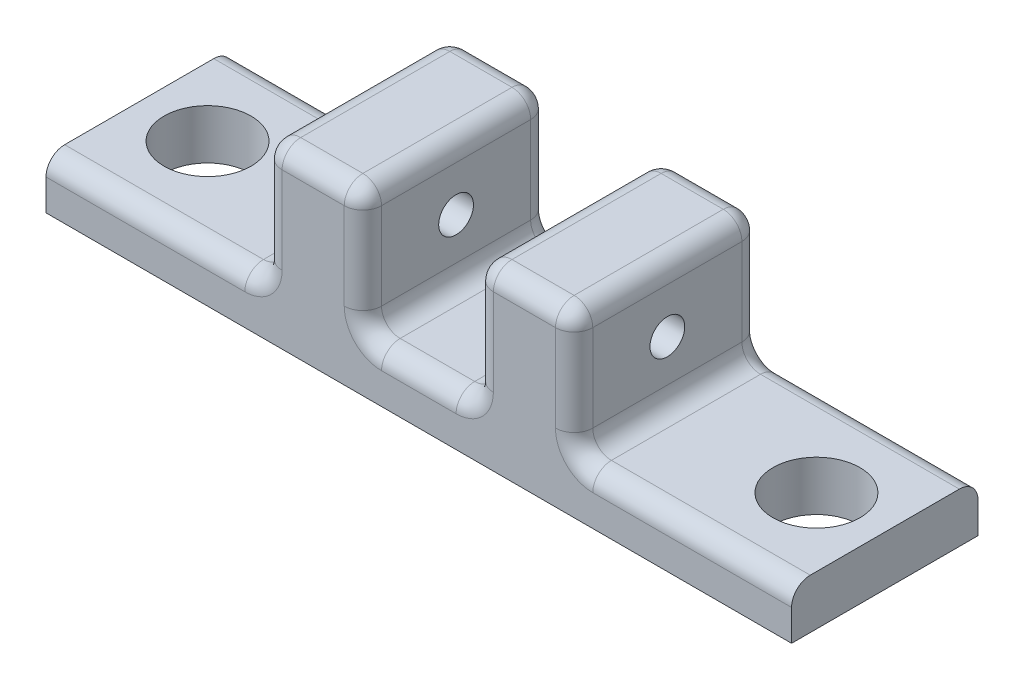
from build123d import *

# Parameters (mm, degrees)
SKETCH3_W               = 60
SKETCH3_H               = 15
SKETCH3_R               = 3.5
BOSS_EXTRUDE1_DEPTH     = 4
SKETCH6_W               = 8
SKETCH6_H               = 15
BOSS_EXTRUDE2_DEPTH     = 10
FILLET2_R               = 1.5
CUT_EXTRUDE1_DEPTH      = 46.370695388
CUT_EXTRUDE1_DEPTH_BACK = 46.370695388
SKETCH7_R               = 1.4


with BuildPart() as part:
    # Sketch3 → Boss-Extrude1 (new body)
    with BuildSketch(Plane(origin=(0, 0, 0), x_dir=(1, 0, 0), z_dir=(0, 1, 0))):
        Rectangle(SKETCH3_W, SKETCH3_H)
        with Locations(Location((-24.5, 0, 0), (0, 0, 270))):
            Circle(SKETCH3_R, mode=Mode.SUBTRACT)
        with Locations(Location((24.5, 0, 0), (0, 0, 270))):
            Circle(SKETCH3_R, mode=Mode.SUBTRACT)
    extrude(amount=BOSS_EXTRUDE1_DEPTH)

    # Sketch6 → Boss-Extrude2 (add)
    with BuildSketch(Plane(origin=(0, 4, 0), x_dir=(1, 0, 0), z_dir=(0, 1, 0))):
        with Locations((-8.5, 0)):
            Rectangle(SKETCH6_W, SKETCH6_H)
    boss_extrude2 = extrude(amount=BOSS_EXTRUDE2_DEPTH)

    # Mirror1: Boss-Extrude2 across plane
    add(boss_extrude2.mirror(Plane(origin=(0, 0, 0), x_dir=(0, 0, 1), z_dir=(1, 0, 0))))

    # Fillet2
    fillet2_edges = [part.edges().sort_by_distance(p)[0] for p in [
        (-21.25, 4, 7.5),
        (-21.25, 4, -7.5),
        (0, 4, 7.5),
        (-12.5, 4, 0),
        (-12.5, 9, -7.5),
        (-12.5, 9, 7.5),
        (-4.5, 4, 0),
        (-4.5, 9, 7.5),
        (-4.5, 9, -7.5),
        (-12.5, 14, 0),
        (-8.5, 14, 7.5),
        (-4.5, 14, 0),
        (-8.5, 14, -7.5),
        (21.25, 4, 7.5),
        (0, 4, -7.5),
        (12.5, 14, 0),
        (12.5, 9, 7.5),
        (8.5, 14, -7.5),
        (12.5, 9, -7.5),
        (4.5, 14, 0),
        (4.5, 9, -7.5),
        (8.5, 14, 7.5),
        (4.5, 9, 7.5),
        (12.5, 4, 0),
        (4.5, 4, 0),
        (21.25, 4, -7.5),
    ]]
    fillet(fillet2_edges, radius=FILLET2_R)

    # Sketch7 → Cut-Extrude1 (cut, two sides: drawn at the far end of the back side and taken through both)
    with BuildSketch(Plane.ZY.offset(12.5).offset(-CUT_EXTRUDE1_DEPTH_BACK)):
        with Locations((0, 8.870600297)):
            Circle(SKETCH7_R)
    extrude(amount=CUT_EXTRUDE1_DEPTH + CUT_EXTRUDE1_DEPTH_BACK, mode=Mode.SUBTRACT)


solid = part.part
